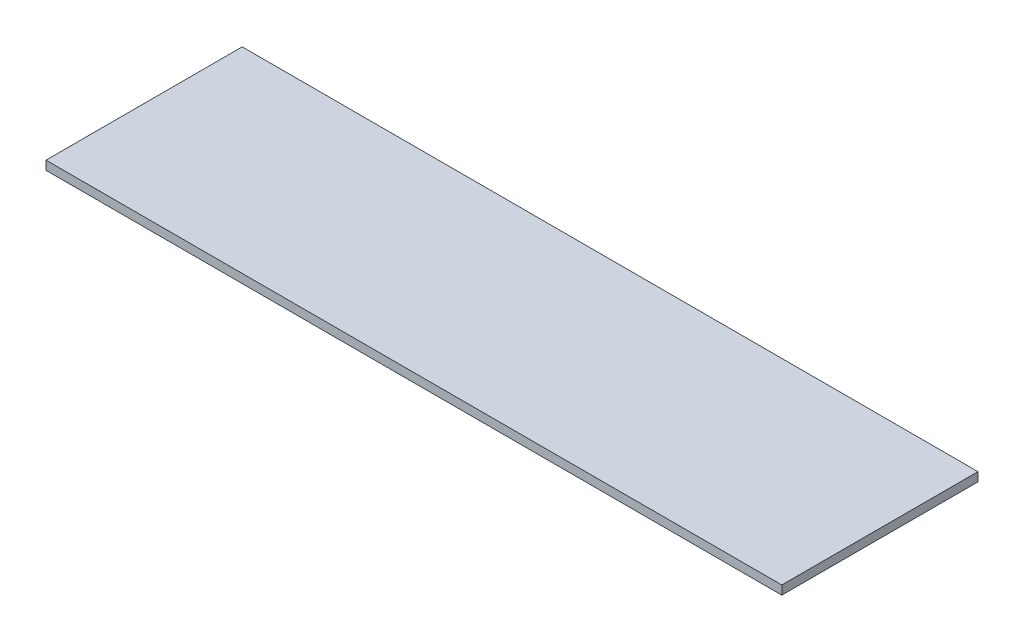
from build123d import *

# Parameters (mm, degrees)
ESQUISSE1_W        = 1500
ESQUISSE1_H        = 400
BOSS_EXTRU_1_DEPTH = 18


with BuildPart() as part:
    # Esquisse1 → Boss.-Extru.1 (new body)
    with BuildSketch(Plane(origin=(0, 0, 0), x_dir=(1, 0, 0), z_dir=(0, 1, 0))):
        Rectangle(ESQUISSE1_W, ESQUISSE1_H)
    extrude(amount=BOSS_EXTRU_1_DEPTH)


solid = part.part
